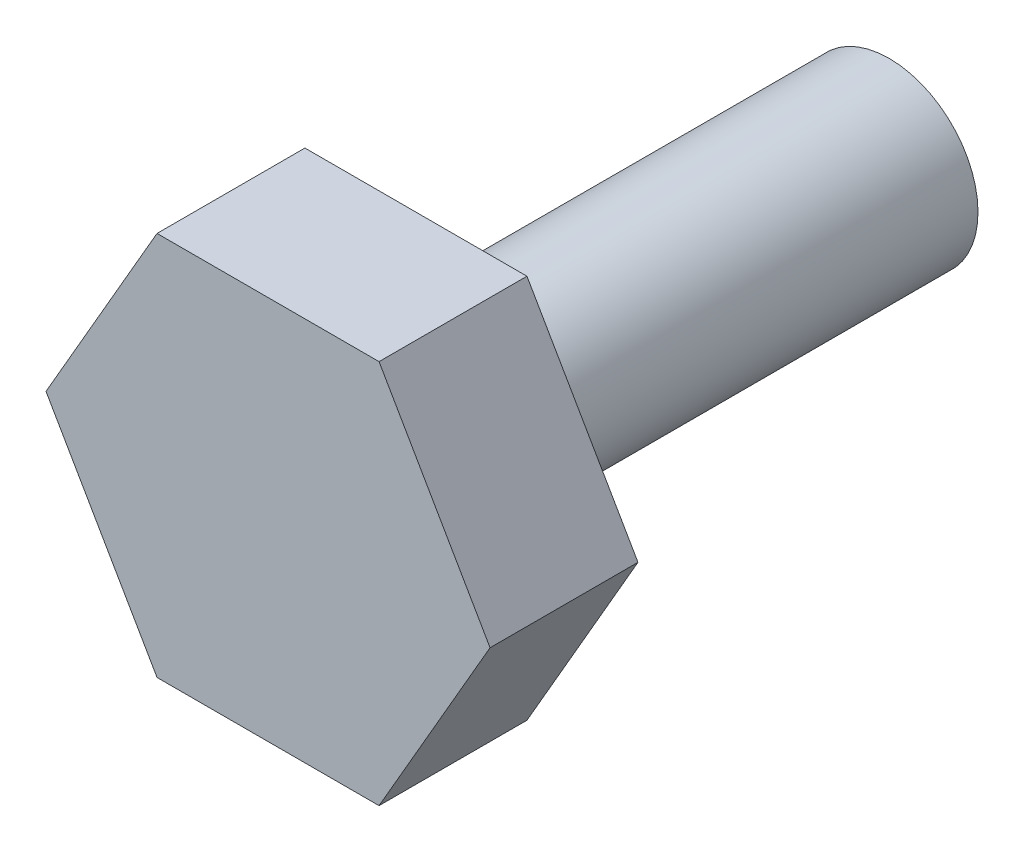
from build123d import *

# Parameters (mm, degrees)
BOSS_EXTRUDE1_DEPTH = 6.35
SKETCH2_R           = 3.81
BOSS_EXTRUDE2_DEPTH = 20.32


with BuildPart() as part:
    # Sketch1 → Boss-Extrude1 (new body)
    with BuildSketch(Plane.XY):
        Polygon((4.766026472, -8.255), (9.532052944, 0), (4.766026472, 8.255), (-4.766026472, 8.255), (-9.532052944, 0), (-4.766026472, -8.255), align=None)
    extrude(amount=BOSS_EXTRUDE1_DEPTH)

    # Sketch2 → Boss-Extrude2 (add)
    with BuildSketch(Plane(origin=(0, 0, 0), x_dir=(-1, 0, 0), z_dir=(0, 0, -1))):
        with Locations(Location((0, 0, 0), (0, 0, 180))):
            Circle(SKETCH2_R)
    extrude(amount=BOSS_EXTRUDE2_DEPTH)


solid = part.part
